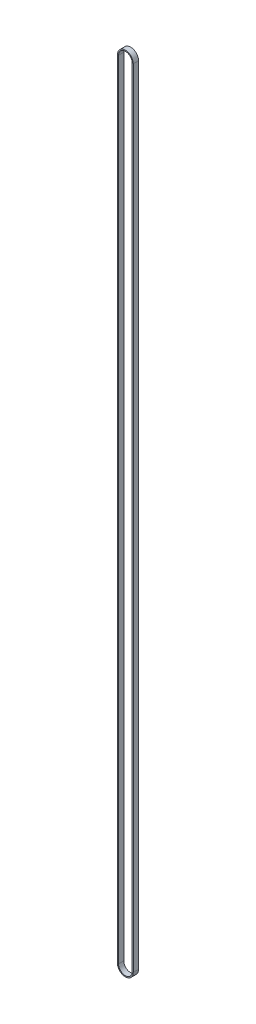
from build123d import *

# Parameters (mm, degrees)
EXTRUDE_1_DEPTH = 5


with BuildPart() as part:
    # 草圖1 → 填料-伸長1 (new body)
    with BuildSketch(Plane.XY):
        with BuildLine():
            Line((7.5, 753.5), (7.5, 6.5))
            ThreePointArc((7.5, 6.5), (0, -1), (-7.5, 6.5))
            Line((-7.5, 6.5), (-7.5, 753.5))
            ThreePointArc((-7.5, 753.5), (0, 761), (7.5, 753.5))
        make_face()
        with BuildLine():
            Line((6.5, 753.5), (6.5, 6.5))
            ThreePointArc((6.5, 6.5), (0, 0), (-6.5, 6.5))
            Line((-6.5, 6.5), (-6.5, 753.5))
            ThreePointArc((-6.5, 753.5), (0, 760), (6.5, 753.5))
        make_face(mode=Mode.SUBTRACT)
    extrude(amount=EXTRUDE_1_DEPTH)


solid = part.part
